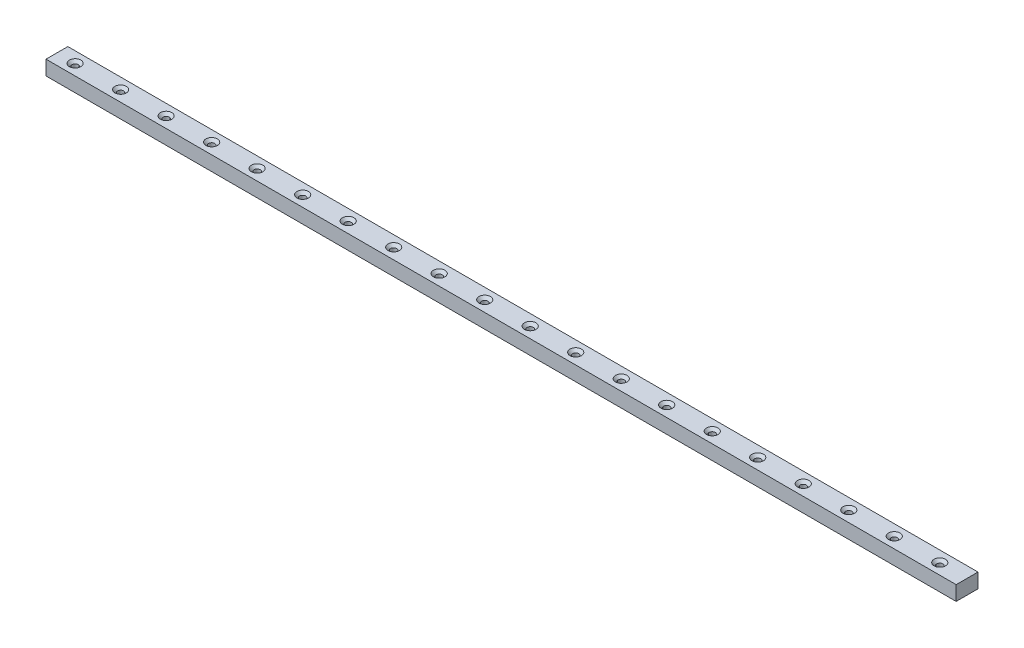
from build123d import *

# Parameters (mm, degrees)
SKETCH1_W                                       = 12
SKETCH1_H                                       = 8
BOSS_EXTRUDE1_DEPTH                             = 500
CSK_FOR_M3_FLAT_HEAD_MACHINE_SCREW1_D           = 3.4
CSK_FOR_M3_FLAT_HEAD_MACHINE_SCREW1_CSINK_D     = 6.3
CSK_FOR_M3_FLAT_HEAD_MACHINE_SCREW1_CSINK_ANGLE = 90
LPATTERN1_COUNT                                 = 20
LPATTERN1_PITCH                                 = 25


with BuildPart() as part:
    # Sketch1 → Boss-Extrude1 (new body)
    with BuildSketch(Plane(origin=(0, 0, 0), x_dir=(0, 0, -1), z_dir=(1, 0, 0))):
        Rectangle(SKETCH1_W, SKETCH1_H)
    extrude(amount=BOSS_EXTRUDE1_DEPTH)

    # CSK for M3 Flat Head Machine Screw1 (through all)
    with Locations(Plane(origin=(0, 4, 0), x_dir=(1, 0, 0), z_dir=(0, 1, 0))):
        with Locations((10, 0)):
            csk_for_m3_flat_head_machine_screw1 = CounterSinkHole(CSK_FOR_M3_FLAT_HEAD_MACHINE_SCREW1_D / 2, CSK_FOR_M3_FLAT_HEAD_MACHINE_SCREW1_CSINK_D / 2, counter_sink_angle=CSK_FOR_M3_FLAT_HEAD_MACHINE_SCREW1_CSINK_ANGLE)

    # LPattern1: CSK for M3 Flat Head Machine Screw1 ×20
    with Locations(*[(i * LPATTERN1_PITCH, 0, 0) for i in range(1, LPATTERN1_COUNT)]):
        add(csk_for_m3_flat_head_machine_screw1, mode=Mode.SUBTRACT)


solid = part.part
